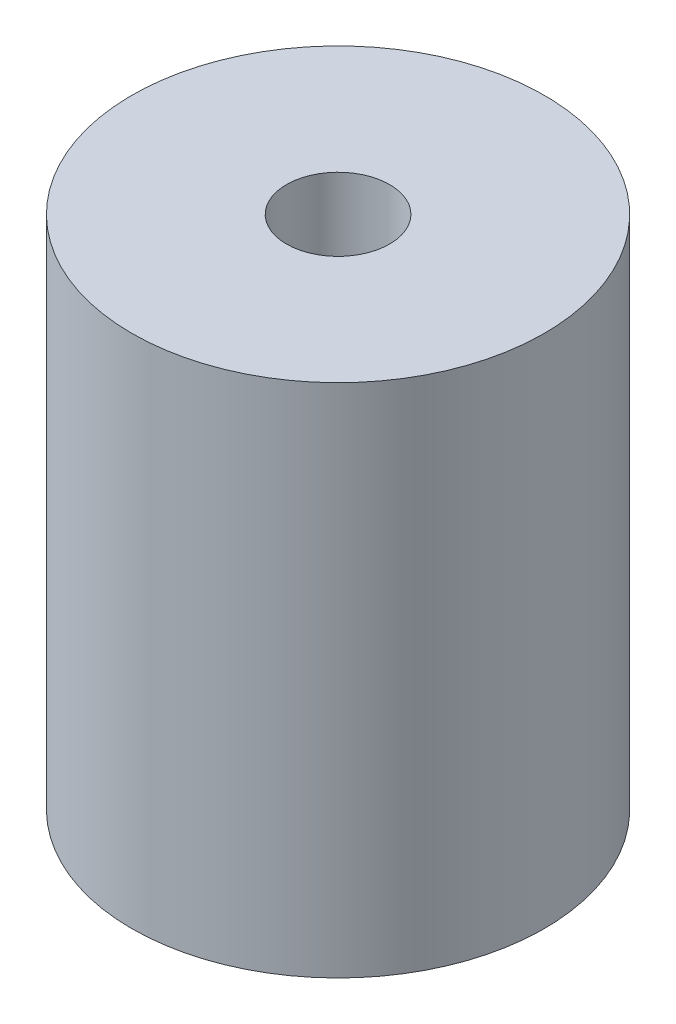
from build123d import *

# Parameters (mm, degrees)
SKETCH1_R           = 10
BOSS_EXTRUDE1_DEPTH = 12.5
SKETCH2_R           = 2.5
CUT_EXTRUDE1_DEPTH  = 19.874586088
SKETCH3_R           = 4
CUT_EXTRUDE2_DEPTH  = 12.5


with BuildPart() as part:
    # Sketch1 → Boss-Extrude1 (new, symmetric)
    with BuildSketch(Plane(origin=(0, 0, 0), x_dir=(1, 0, 0), z_dir=(0, 1, 0))):
        with Locations(Location((0, 0, 0), (0, 0, 270))):
            Circle(SKETCH1_R)
    extrude(amount=BOSS_EXTRUDE1_DEPTH, both=True)

    # Sketch2 → Cut-Extrude1 (cut, through all)
    with BuildSketch(Plane(origin=(0, 0, 0), x_dir=(1, 0, 0), z_dir=(0, 1, 0))):
        with Locations(Location((0, 0, 0), (0, 0, 270))):
            Circle(SKETCH2_R)
    extrude(amount=CUT_EXTRUDE1_DEPTH, mode=Mode.SUBTRACT)

    # Sketch3 → Cut-Extrude2 (cut)
    with BuildSketch(Plane.XZ.offset(12.5)):
        with Locations(Location((0, 0, 0), (0, 0, 270))):
            Circle(SKETCH3_R)
    extrude(amount=-CUT_EXTRUDE2_DEPTH, mode=Mode.SUBTRACT)


solid = part.part
